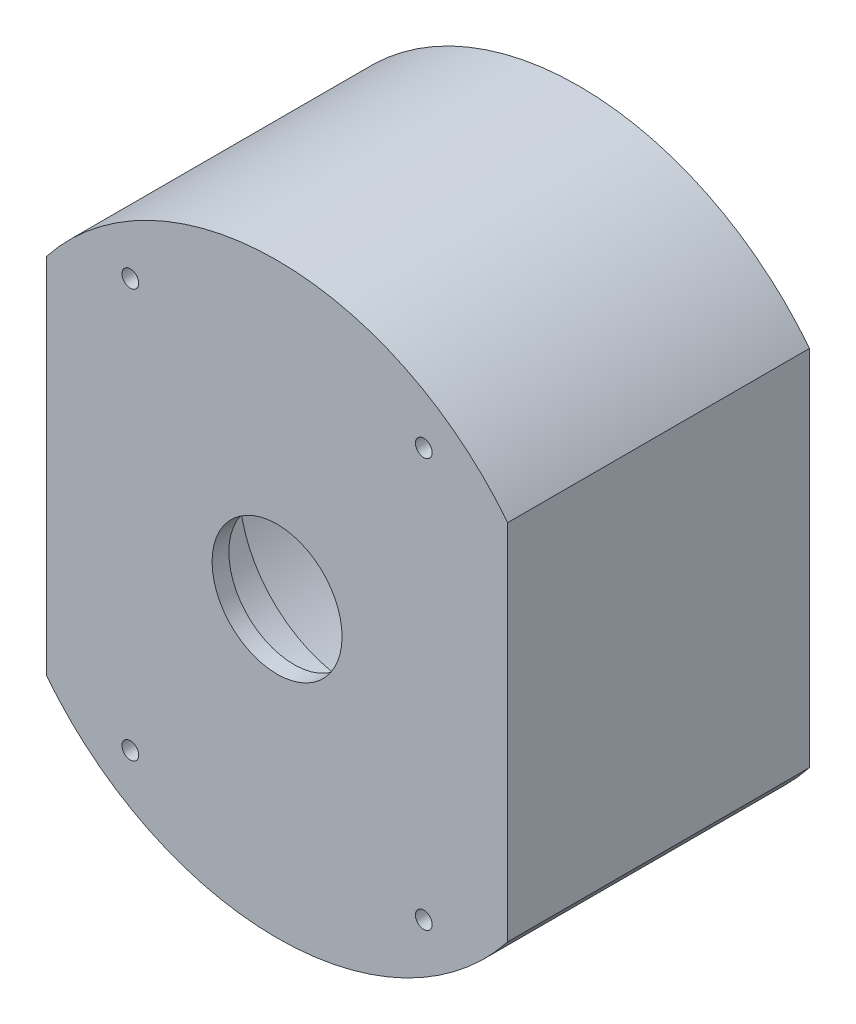
from build123d import *

# Parameters (mm, degrees)
SKETCH1_R           = 50.25
BOSS_EXTRUDE1_DEPTH = 53.5
SKETCH2_R           = 50.5
CUT_EXTRUDE1_DEPTH  = 31
SKETCH3_R           = 27.5
BOSS_EXTRUDE2_DEPTH = 13.5
SKETCH8_R           = 15.5
BOSS_EXTRUDE4_DEPTH = 5
SKETCH9_R           = 2
CUT_EXTRUDE5_DEPTH  = 115.494541355
SKETCH10_R          = 22.5
CUT_EXTRUDE6_DEPTH  = 1


with BuildPart() as part:
    # Sketch1 → Boss-Extrude1 (new body)
    with BuildSketch(Plane.XY):
        with BuildLine():
            Line((-55, 43.301270189), (-55, -43.301270189))
            ThreePointArc((-55, -43.301270189), (0, -70), (55, -43.301270189))
            Line((55, -43.301270189), (55, 43.301270189))
            ThreePointArc((55, 43.301270189), (0, 70), (-55, 43.301270189))
        make_face()
        Circle(SKETCH1_R, mode=Mode.SUBTRACT)
    extrude(amount=BOSS_EXTRUDE1_DEPTH)

    # Sketch2 → Cut-Extrude1 (cut)
    with BuildSketch(Plane.XY.offset(53.5)):
        Circle(SKETCH2_R)
    extrude(amount=-CUT_EXTRUDE1_DEPTH, mode=Mode.SUBTRACT)

    # Sketch3 → Boss-Extrude2 (add)
    with BuildSketch(Plane.XY.offset(53.5)):
        with BuildLine():
            Line((-55, -43.301270189), (-55, 43.301270189))
            ThreePointArc((-55, 43.301270189), (0, 70), (55, 43.301270189))
            Line((55, 43.301270189), (55, -43.301270189))
            ThreePointArc((55, -43.301270189), (0, -70), (-55, -43.301270189))
        make_face()
        Circle(SKETCH3_R, mode=Mode.SUBTRACT)
    extrude(amount=BOSS_EXTRUDE2_DEPTH)

    # Sketch8 → Boss-Extrude4 (add)
    with BuildSketch(Plane.XY.offset(67)):
        with BuildLine():
            Line((-55, 43.301270189), (-55, -43.301270189))
            ThreePointArc((-55, -43.301270189), (0, -70), (55, -43.301270189))
            Line((55, -43.301270189), (55, 43.301270189))
            ThreePointArc((55, 43.301270189), (0, 70), (-55, 43.301270189))
        make_face()
        Circle(SKETCH8_R, mode=Mode.SUBTRACT)
    extrude(amount=BOSS_EXTRUDE4_DEPTH)

    # Sketch9 → Cut-Extrude5 (cut, through all)
    with BuildSketch(Plane.XY.offset(72)):
        with Locations((-35, -48.733971724)):
            Circle(SKETCH9_R)
        with Locations((-35, 48.733971724)):
            Circle(SKETCH9_R)
        with Locations((35, 48.733971724)):
            Circle(SKETCH9_R)
        with Locations((35, -48.733971724)):
            Circle(SKETCH9_R)
    extrude(amount=-CUT_EXTRUDE5_DEPTH, mode=Mode.SUBTRACT)

    # Sketch10 → Cut-Extrude6 (cut)
    with BuildSketch(Plane(origin=(0, 0, 67), x_dir=(-1, 0, 0), z_dir=(0, 0, -1))):
        Circle(SKETCH10_R)
    extrude(amount=-CUT_EXTRUDE6_DEPTH, mode=Mode.SUBTRACT)


solid = part.part
